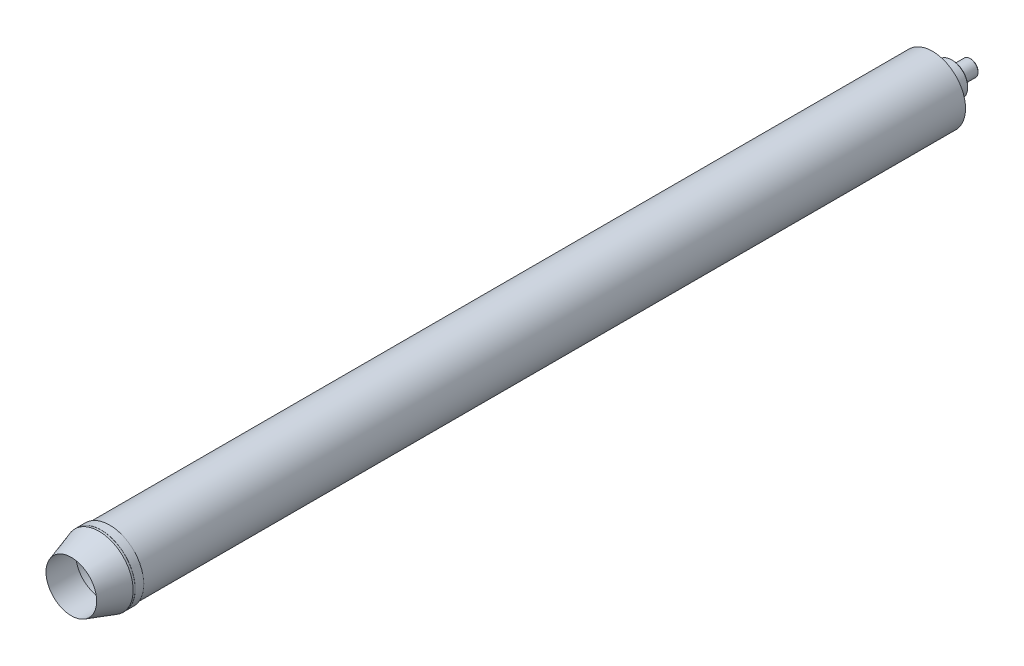
from build123d import *

# Parameters (mm, degrees)
SKETCH1_R                   = 49.2125
SKETCH1_R_2                 = 47.625
BOSS_EXTRUDE1_DEPTH         = 1225.804
SKETCH2_R                   = 50.8
SKETCH2_R_2                 = 47.625
BOSS_EXTRUDE2_DEPTH         = 12.7
SKETCH3_R                   = 47.625
BOSS_EXTRUDE3_DEPTH         = 6.35
SKETCH4_R                   = 23.876
BOSS_EXTRUDE4_DEPTH         = 29.845
SKETCH5_R                   = 11.938
BOSS_EXTRUDE5_DEPTH         = 27.305
CHAMFER1_SIZE               = 1.27
F_3_8_16_TAPPED_HOLE1_D     = 7.9375
F_3_8_16_TAPPED_HOLE1_DEPTH = 26.9875
F_3_8_16_TAPPED_HOLE1_TIP   = 2.384665582
CUT_EXTRUDE1_START          = -3.175
SKETCH8_R                   = 46.0375
SKETCH8_R_2                 = 23.876
CUT_EXTRUDE1_DEPTH          = 3.175


with BuildPart() as part:
    # Sketch1 → Boss-Extrude1 (new body)
    with BuildSketch(Plane.XY):
        Circle(SKETCH1_R)
        Circle(SKETCH1_R_2, mode=Mode.SUBTRACT)
    extrude(amount=BOSS_EXTRUDE1_DEPTH)

    # Sketch2 → Boss-Extrude2 (add)
    with BuildSketch(Plane.XY.offset(1225.804)):
        Circle(SKETCH2_R)
        Circle(SKETCH2_R_2, mode=Mode.SUBTRACT)
    extrude(amount=BOSS_EXTRUDE2_DEPTH)

    # Sketch3 → Boss-Extrude3 (add)
    with BuildSketch(Plane.XY):
        Circle(SKETCH3_R)
    extrude(amount=BOSS_EXTRUDE3_DEPTH)

    # Sketch4 → Boss-Extrude4 (add)
    with BuildSketch(Plane(origin=(0, 0, 0), x_dir=(-1, 0, 0), z_dir=(0, 0, -1))):
        with Locations(Location((0, 0, 0), (0, 0, 180))):
            Circle(SKETCH4_R)
    extrude(amount=BOSS_EXTRUDE4_DEPTH)

    # Sketch5 → Boss-Extrude5 (add)
    with BuildSketch(Plane(origin=(0, 0, -29.845), x_dir=(-1, 0, 0), z_dir=(0, 0, -1))):
        Circle(SKETCH5_R)
    extrude(amount=BOSS_EXTRUDE5_DEPTH)

    # Chamfer1
    chamfer1_edges = [part.edges().sort_by_distance(p)[0] for p in [
        (-23.876, 0, -29.845),
        (11.938, 0, -57.15),
    ]]
    chamfer(chamfer1_edges, length=CHAMFER1_SIZE)

    # 3/8-16 Tapped Hole1
    with Locations(Plane(origin=(0, 0, -57.15), x_dir=(-1, 0, 0), z_dir=(0, 0, -1))):
        with Locations((0, 0)):
            Hole(F_3_8_16_TAPPED_HOLE1_D / 2, depth=F_3_8_16_TAPPED_HOLE1_DEPTH)
            with Locations((0, 0, -(F_3_8_16_TAPPED_HOLE1_DEPTH + F_3_8_16_TAPPED_HOLE1_TIP / 2))):  # 118° drill point
                Cone(0, F_3_8_16_TAPPED_HOLE1_D / 2, F_3_8_16_TAPPED_HOLE1_TIP, mode=Mode.SUBTRACT)

    # Sketch8 → Cut-Extrude1 (cut)
    with BuildSketch(Plane(origin=(0, 0, 0), x_dir=(-1, 0, 0), z_dir=(0, 0, -1)).offset(CUT_EXTRUDE1_START)):
        Circle(SKETCH8_R)
        with Locations(Location((0, 0, 0), (0, 0, 180))):
            Circle(SKETCH8_R_2, mode=Mode.SUBTRACT)
    extrude(amount=CUT_EXTRUDE1_DEPTH, mode=Mode.SUBTRACT)

    # Sketch9 → Revolve1 (revolve)
    with BuildSketch(Plane(origin=(0, 0, 0), x_dir=(1, 0, 0), z_dir=(0, 1, 0))):
        Polygon((-50.8, -1238.758), (-50.8, -1241.679), (-37.719, -1282.954), (-37.719, -1238.504), (-50.546, -1238.504), (-50.546, -1238.758), align=None)
    revolve(axis=Axis((0, 0, 1238.504), (0, 0, 1)))


solid = part.part
